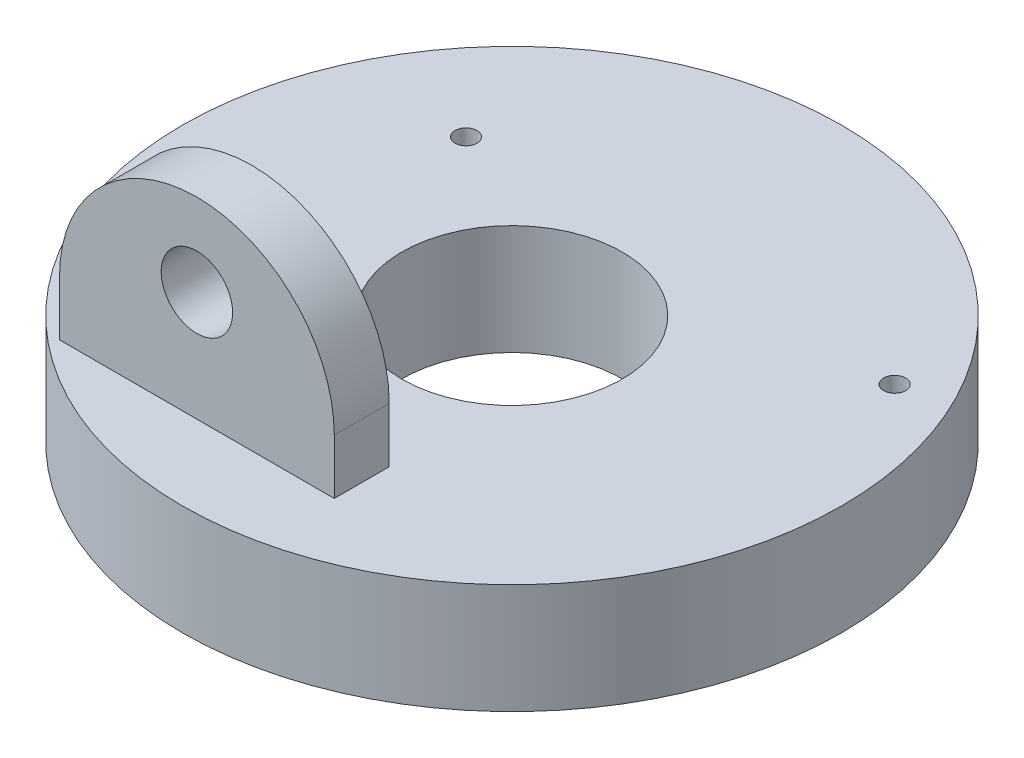
from build123d import *

# Parameters (mm, degrees)
SKETCH1_R           = 60
BOSS_EXTRUDE1_DEPTH = 20
BOSS_EXTRUDE2_DEPTH = 10
SKETCH6_R           = 20.05
CUT_EXTRUDE1_DEPTH  = 92.787798753
SKETCH8_R           = 6.5
CUT_EXTRUDE3_DEPTH  = 10
SKETCH9_R           = 2.000000002
CUT_EXTRUDE4_DEPTH  = 20
SKETCH10_R          = 3.999999996
CUT_EXTRUDE5_DEPTH  = 4


with BuildPart() as part:
    # Sketch1 → Boss-Extrude1 (new body)
    with BuildSketch(Plane(origin=(0, 0, 0), x_dir=(1, 0, 0), z_dir=(0, 1, 0))):
        with Locations(Location((0, 0, 0), (0, 0, 270))):
            Circle(SKETCH1_R)
    extrude(amount=BOSS_EXTRUDE1_DEPTH)

    # Sketch2 → Boss-Extrude2 (add)
    with BuildSketch(Plane.XY.offset(45)):
        with BuildLine():
            Line((-37.344891303, 20), (-37.344891303, 30))
            ThreePointArc((-37.344891303, 30), (-12.344891303, 55), (12.655108697, 30))
            Line((12.655108697, 30), (12.655108697, 20))
            Line((12.655108697, 20), (-37.344891303, 20))
        make_face()
    extrude(amount=-BOSS_EXTRUDE2_DEPTH)

    # Sketch6 → Cut-Extrude1 (cut, through all)
    with BuildSketch(Plane(origin=(0, 20, 0), x_dir=(1, 0, 0), z_dir=(0, 1, 0))):
        with Locations(Location((0, 0, 0), (0, 0, 270))):
            Circle(SKETCH6_R)
    extrude(amount=-CUT_EXTRUDE1_DEPTH, mode=Mode.SUBTRACT)

    # Sketch8 → Cut-Extrude3 (cut)
    with BuildSketch(Plane.XY.offset(45)):
        with Locations((-12.344891303, 40)):
            Circle(SKETCH8_R)
    extrude(amount=-CUT_EXTRUDE3_DEPTH, mode=Mode.SUBTRACT)

    # Sketch9 → Cut-Extrude4 (cut)
    with BuildSketch(Plane(origin=(0, 20, 0), x_dir=(1, 0, 0), z_dir=(0, 1, 0))):
        with Locations(Location((45.655108698, 23.978394329, 0), (0, 0, 270))):
            Circle(SKETCH9_R)
        with Locations(Location((-32.344891302, 23.978394329, 0), (0, 0, 270))):
            Circle(SKETCH9_R)
    extrude(amount=-CUT_EXTRUDE4_DEPTH, mode=Mode.SUBTRACT)

    # Sketch10 → Cut-Extrude5 (cut)
    with BuildSketch(Plane.XZ):
        with Locations(Location((45.655108698, -23.978394329, 0), (0, 0, 270))):
            Circle(SKETCH10_R)
        with Locations(Location((-32.344891302, -23.978394329, 0), (0, 0, 270))):
            Circle(SKETCH10_R)
    extrude(amount=-CUT_EXTRUDE5_DEPTH, mode=Mode.SUBTRACT)


solid = part.part
